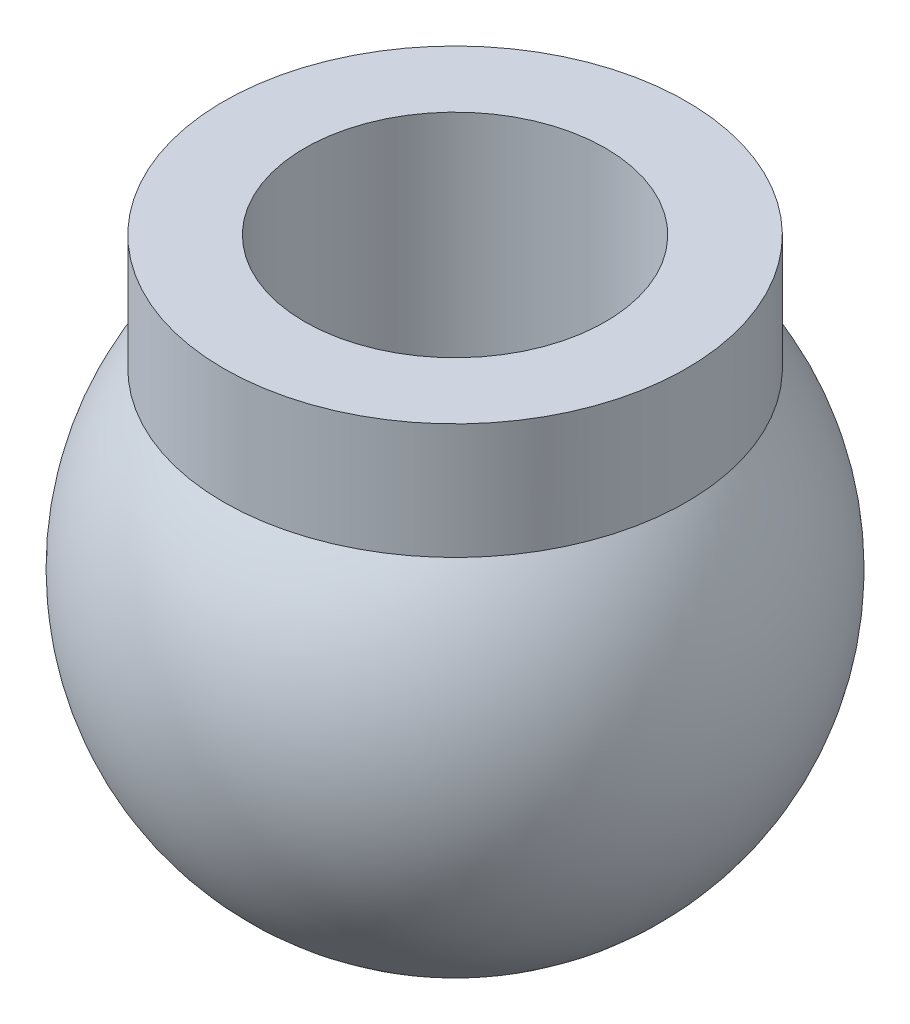
from build123d import *

# Parameters (mm, degrees)
SKETCH2_R           = 1.3
CUT_EXTRUDE1_DEPTH  = 15
BOSS_EXTRUDE1_START = 2.5
SKETCH3_R           = 2
SKETCH3_R_2         = 1.3
BOSS_EXTRUDE1_DEPTH = 2.5


with BuildPart() as part:
    # Sketch1 → Revolve2 (revolve)
    with BuildSketch(Plane.XY):
        with BuildLine():
            Line((-2.5, 0), (2.5, 0))
            ThreePointArc((2.5, 0), (0, -2.5), (-2.5, 0))
        make_face()
    revolve(axis=Axis((4.664316952, 0, 0), (-1, 0, 0)))

    # Sketch2 → Cut-Extrude1 (cut, symmetric)
    with BuildSketch(Plane(origin=(0, 0, 0), x_dir=(1, 0, 0), z_dir=(0, 1, 0))):
        with Locations(Location((0, 0, 0), (0, 0, 90))):
            Circle(SKETCH2_R)
    extrude(amount=CUT_EXTRUDE1_DEPTH, both=True, mode=Mode.SUBTRACT)

    # Sketch3 → Boss-Extrude1 (add)
    with BuildSketch(Plane(origin=(0, 0, 0), x_dir=(1, 0, 0), z_dir=(0, 1, 0)).offset(BOSS_EXTRUDE1_START)):
        with Locations(Location((0, 0, 0), (0, 0, 270))):
            Circle(SKETCH3_R)
        with Locations(Location((0, 0, 0), (0, 0, 270))):
            Circle(SKETCH3_R_2, mode=Mode.SUBTRACT)
    extrude(amount=-BOSS_EXTRUDE1_DEPTH)


solid = part.part
